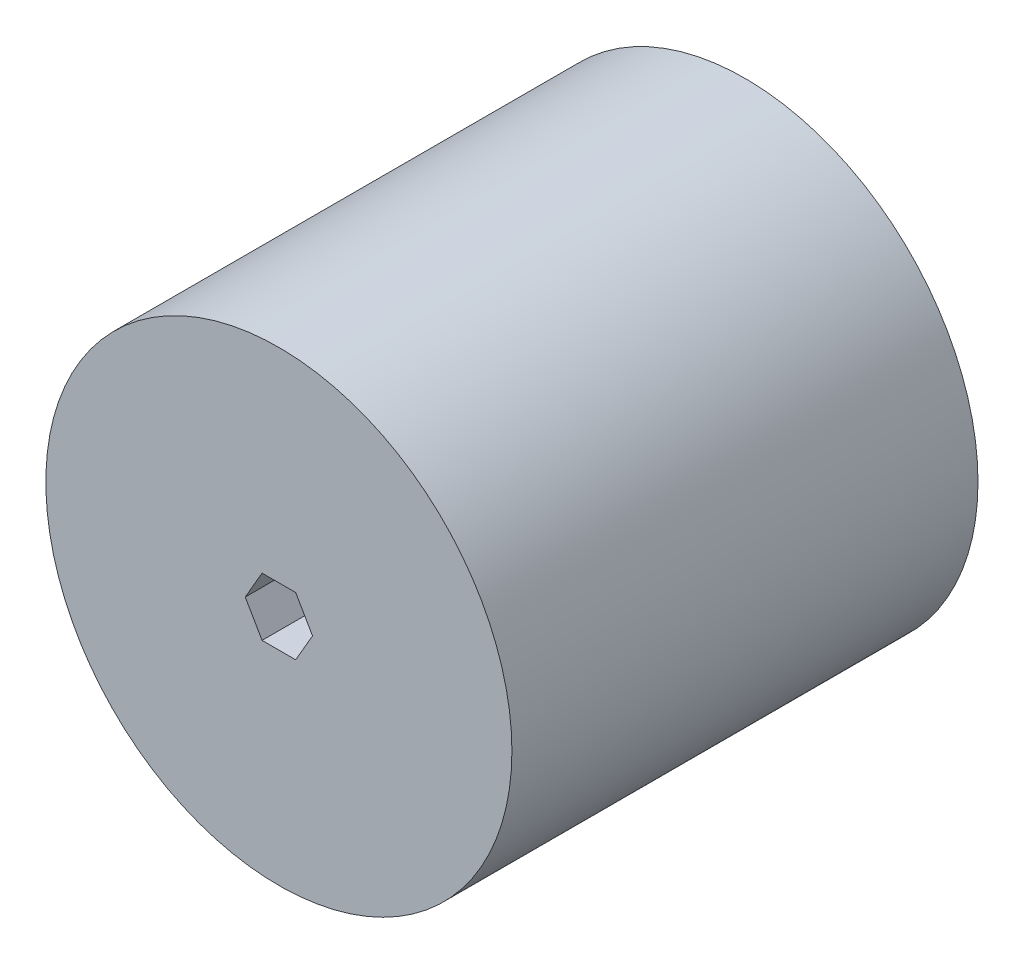
from build123d import *

# Parameters (mm, degrees)
SKETCH1_R           = 50.8
BOSS_EXTRUDE1_DEPTH = 101.6


with BuildPart() as part:
    # Sketch1 → Boss-Extrude1 (new body)
    with BuildSketch(Plane.XY):
        Circle(SKETCH1_R)
        Polygon((-7.332348419, 0), (-3.666174209, -6.35), (3.666174209, -6.35), (7.332348419, 0), (3.666174209, 6.35), (-3.666174209, 6.35), align=None, mode=Mode.SUBTRACT)
    extrude(amount=BOSS_EXTRUDE1_DEPTH)


solid = part.part
